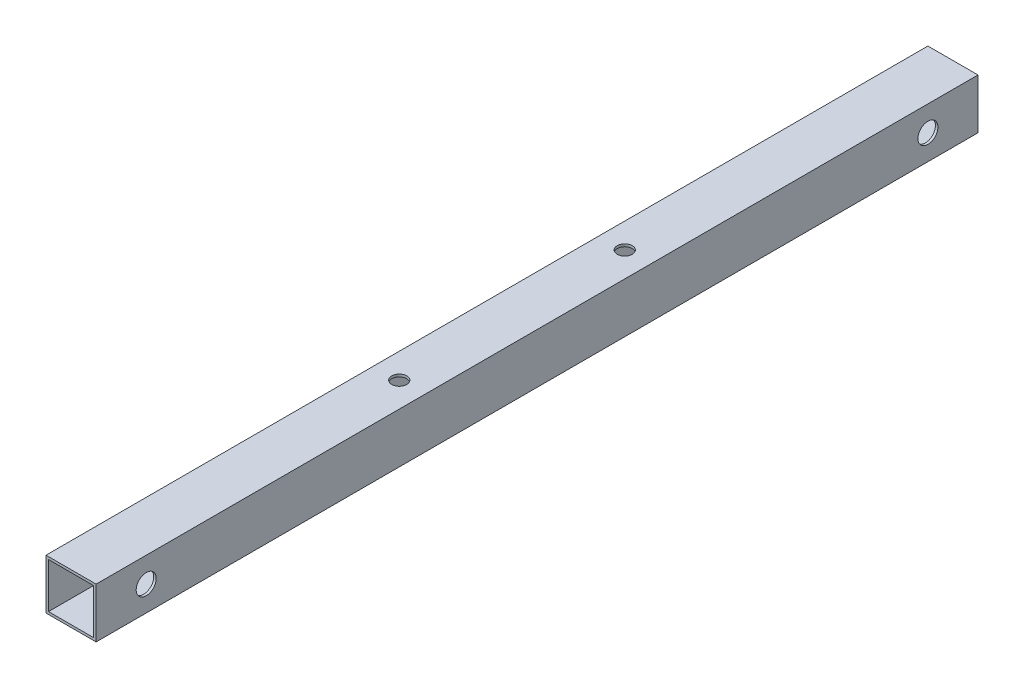
from build123d import *

# Parameters (mm, degrees)
SKETCH_1_W          = 10
SKETCH_1_H          = 10
SKETCH_1_W_2        = 9
SKETCH_1_H_2        = 9
EXTRUDE_1_DEPTH     = 176
SKETCH_2_R          = 2
CUT_EXTRUDE_1_DEPTH = 176
SKETCH_3_R          = 1.5
CUT_EXTRUDE_2_DEPTH = 176


with BuildPart() as part:
    # 草图1 → 凸台-拉伸1 (new body)
    with BuildSketch(Plane.XY):
        Rectangle(SKETCH_1_W, SKETCH_1_H)
        Rectangle(SKETCH_1_W_2, SKETCH_1_H_2, mode=Mode.SUBTRACT)
    extrude(amount=EXTRUDE_1_DEPTH)

    # 草图2 → 切除-拉伸1 (cut)
    with BuildSketch(Plane.ZY.offset(5)):
        with Locations(Location((10, 0, 0), (0, 0, 270))):
            Circle(SKETCH_2_R)
        with Locations(Location((166, 0, 0), (0, 0, 270))):
            Circle(SKETCH_2_R)
    extrude(amount=-CUT_EXTRUDE_1_DEPTH, mode=Mode.SUBTRACT)

    # 草图3 → 切除-拉伸2 (cut)
    with BuildSketch(Plane(origin=(0, 5, 0), x_dir=(1, 0, 0), z_dir=(0, 1, 0))):
        with Locations(Location((0, -65.5, 0), (0, 0, 270))):
            Circle(SKETCH_3_R)
        with Locations(Location((0, -110.5, 0), (0, 0, 270))):
            Circle(SKETCH_3_R)
    extrude(amount=-CUT_EXTRUDE_2_DEPTH, mode=Mode.SUBTRACT)


solid = part.part
